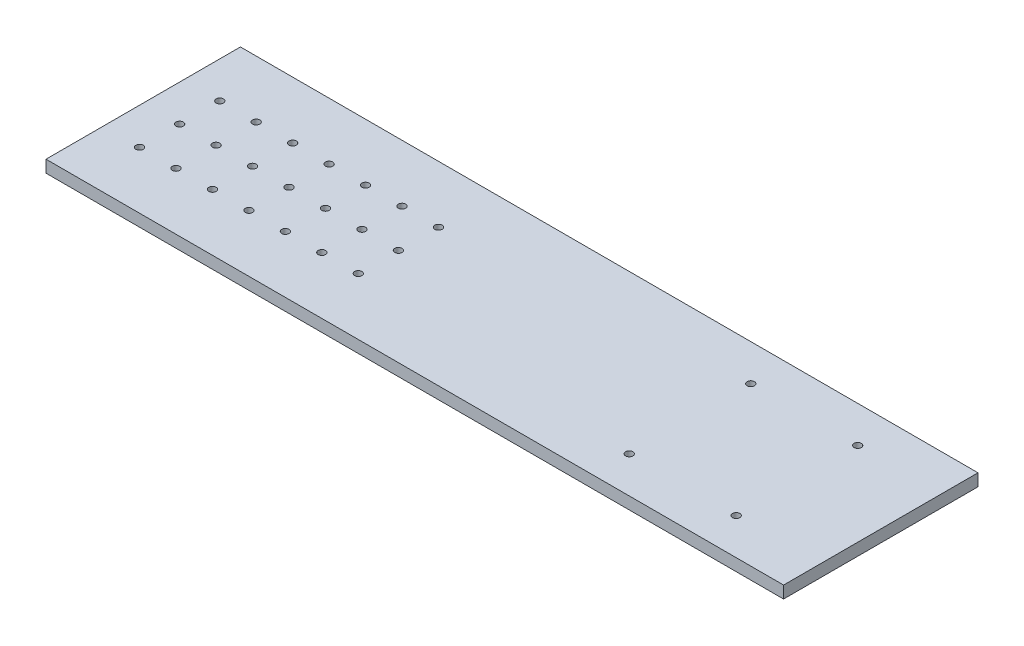
from build123d import *

# Parameters (mm, degrees)
SKETCH1_W           = 607
SKETCH1_H           = 160
BOSS_EXTRUDE1_DEPTH = 10
SKETCH2_R           = 3
CUT_EXTRUDE1_DEPTH  = 10


with BuildPart() as part:
    # Sketch1 → Boss-Extrude1 (new body)
    with BuildSketch(Plane(origin=(0, 0, 0), x_dir=(1, 0, 0), z_dir=(0, 1, 0))):
        Rectangle(SKETCH1_W, SKETCH1_H)
    extrude(amount=BOSS_EXTRUDE1_DEPTH)

    # Sketch2 → Cut-Extrude1 (cut)
    with BuildSketch(Plane.XZ):
        with Locations(Location((-93.5, -33, 0), (0, 0, 270))):
            Circle(SKETCH2_R)
        with Locations(Location((-123.5, -33, 0), (0, 0, 270))):
            Circle(SKETCH2_R)
        with Locations(Location((-153.5, -33, 0), (0, 0, 270))):
            Circle(SKETCH2_R)
        with Locations(Location((-183.5, -33, 0), (0, 0, 270))):
            Circle(SKETCH2_R)
        with Locations(Location((-183.5, 0, 0), (0, 0, 270))):
            Circle(SKETCH2_R)
        with Locations(Location((-183.5, 33, 0), (0, 0, 90))):
            Circle(SKETCH2_R)
        with Locations(Location((-213.5, 33, 0), (0, 0, 90))):
            Circle(SKETCH2_R)
        with Locations(Location((-153.5, 0, 0), (0, 0, 270))):
            Circle(SKETCH2_R)
        with Locations(Location((-213.5, -33, 0), (0, 0, 270))):
            Circle(SKETCH2_R)
        with Locations(Location((-153.5, 33, 0), (0, 0, 90))):
            Circle(SKETCH2_R)
        with Locations(Location((-123.5, 0, 0), (0, 0, 270))):
            Circle(SKETCH2_R)
        with Locations(Location((-123.5, 33, 0), (0, 0, 90))):
            Circle(SKETCH2_R)
        with Locations(Location((-93.5, 0, 0), (0, 0, 270))):
            Circle(SKETCH2_R)
        with Locations(Location((-93.5, 33, 0), (0, 0, 90))):
            Circle(SKETCH2_R)
        with Locations(Location((234.5, 50, 0), (0, 0, 270))):
            Circle(SKETCH2_R)
        with Locations(Location((146.5, 50, 0), (0, 0, 270))):
            Circle(SKETCH2_R)
        with Locations(Location((146.5, -50, 0), (0, 0, 90))):
            Circle(SKETCH2_R)
        with Locations(Location((234.5, -50, 0), (0, 0, 90))):
            Circle(SKETCH2_R)
        with Locations(Location((-243.5, 33, 0), (0, 0, 90))):
            Circle(SKETCH2_R)
        with Locations(Location((-243.5, 0, 0), (0, 0, 270))):
            Circle(SKETCH2_R)
        with Locations(Location((-213.5, 0, 0), (0, 0, 270))):
            Circle(SKETCH2_R)
        with Locations(Location((-243.5, -33, 0), (0, 0, 270))):
            Circle(SKETCH2_R)
        with Locations(Location((-273.5, 33, 0), (0, 0, 90))):
            Circle(SKETCH2_R)
        with Locations(Location((-273.5, 0, 0), (0, 0, 270))):
            Circle(SKETCH2_R)
        with Locations(Location((-273.5, -33, 0), (0, 0, 270))):
            Circle(SKETCH2_R)
    extrude(amount=-CUT_EXTRUDE1_DEPTH, mode=Mode.SUBTRACT)


solid = part.part
